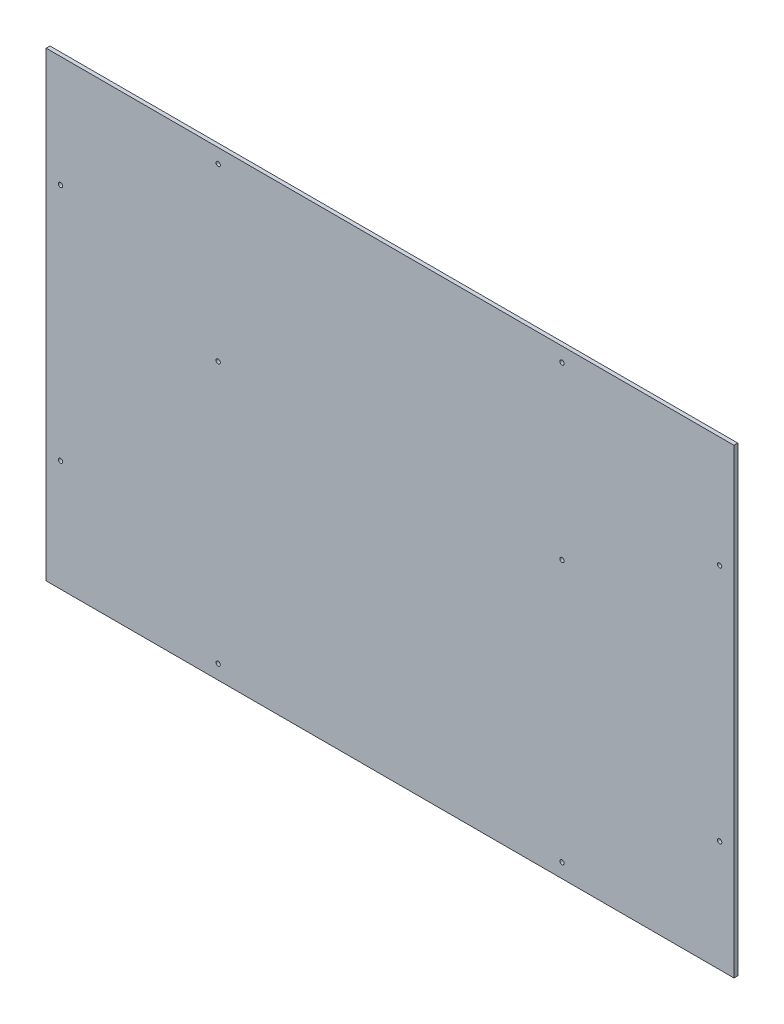
from build123d import *

# Parameters (mm, degrees)
SKETCH1_W           = 720
SKETCH1_H           = 483
BOSS_EXTRUDE1_DEPTH = 2
SKETCH2_R           = 2.25
CUT_EXTRUDE1_DEPTH  = 603.415969244


with BuildPart() as part:
    # Sketch1 → Boss-Extrude1 (new, symmetric)
    with BuildSketch(Plane.XY):
        with Locations((0, -241.5)):
            Rectangle(SKETCH1_W, SKETCH1_H)
    extrude(amount=BOSS_EXTRUDE1_DEPTH, both=True)

    # Sketch2 → Cut-Extrude1 (cut, through all)
    with BuildSketch(Plane(origin=(0, 0, -2), x_dir=(-1, 0, 0), z_dir=(0, 0, -1))):
        with Locations((-345, -116.5)):
            Circle(SKETCH2_R)
        with Locations((-180, -15)):
            Circle(SKETCH2_R)
        with Locations((-180, -194)):
            Circle(SKETCH2_R)
        with Locations(Location((180, -194, 0), (0, 0, 180))):
            Circle(SKETCH2_R)
        with Locations(Location((345, -116.5, 0), (0, 0, 180))):
            Circle(SKETCH2_R)
        with Locations(Location((180, -15, 0), (0, 0, 180))):
            Circle(SKETCH2_R)
        with Locations((-345, -366.5)):
            Circle(SKETCH2_R)
        with Locations(Location((345, -366.5, 0), (0, 0, 180))):
            Circle(SKETCH2_R)
        with Locations((-180, -468)):
            Circle(SKETCH2_R)
        with Locations(Location((180, -468, 0), (0, 0, 180))):
            Circle(SKETCH2_R)
    extrude(amount=-CUT_EXTRUDE1_DEPTH, mode=Mode.SUBTRACT)


solid = part.part
